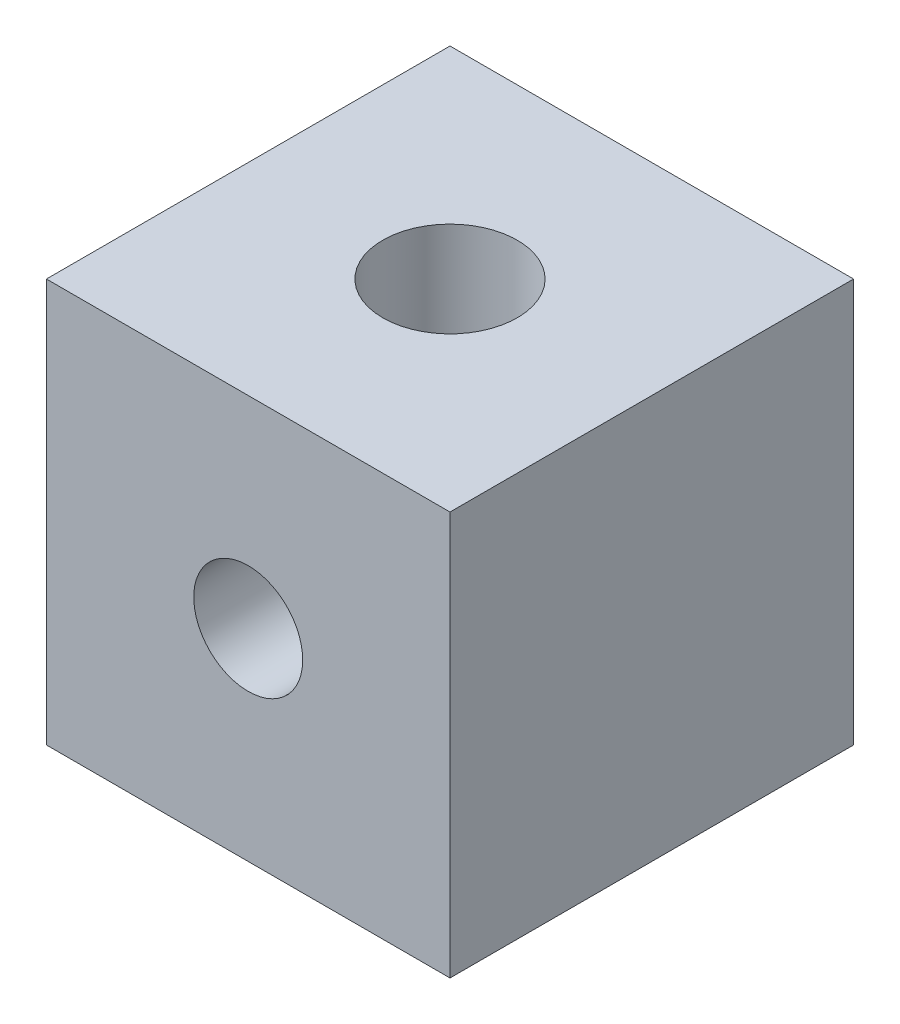
from build123d import *

# Parameters (mm, degrees)
SKETCH1_W           = 38.1
SKETCH1_H           = 38.1
BOSS_EXTRUDE1_DEPTH = 38.1
SKETCH2_R           = 5.1435
CUT_EXTRUDE1_DEPTH  = 38.1
SKETCH3_R           = 6.35
CUT_EXTRUDE2_DEPTH  = 19.05


with BuildPart() as part:
    # Sketch1 → Boss-Extrude1 (new body)
    with BuildSketch(Plane.XY):
        Rectangle(SKETCH1_W, SKETCH1_H)
    extrude(amount=BOSS_EXTRUDE1_DEPTH)

    # Sketch2 → Cut-Extrude1 (cut)
    with BuildSketch(Plane.XY.offset(38.1)):
        Circle(SKETCH2_R)
    extrude(amount=-CUT_EXTRUDE1_DEPTH, mode=Mode.SUBTRACT)

    # Sketch3 → Cut-Extrude2 (cut)
    with BuildSketch(Plane(origin=(0, 19.05, 0), x_dir=(1, 0, 0), z_dir=(0, 1, 0))):
        with Locations(Location((0, -19.05, 0), (0, 0, 270))):
            Circle(SKETCH3_R)
    extrude(amount=-CUT_EXTRUDE2_DEPTH, mode=Mode.SUBTRACT)


solid = part.part
